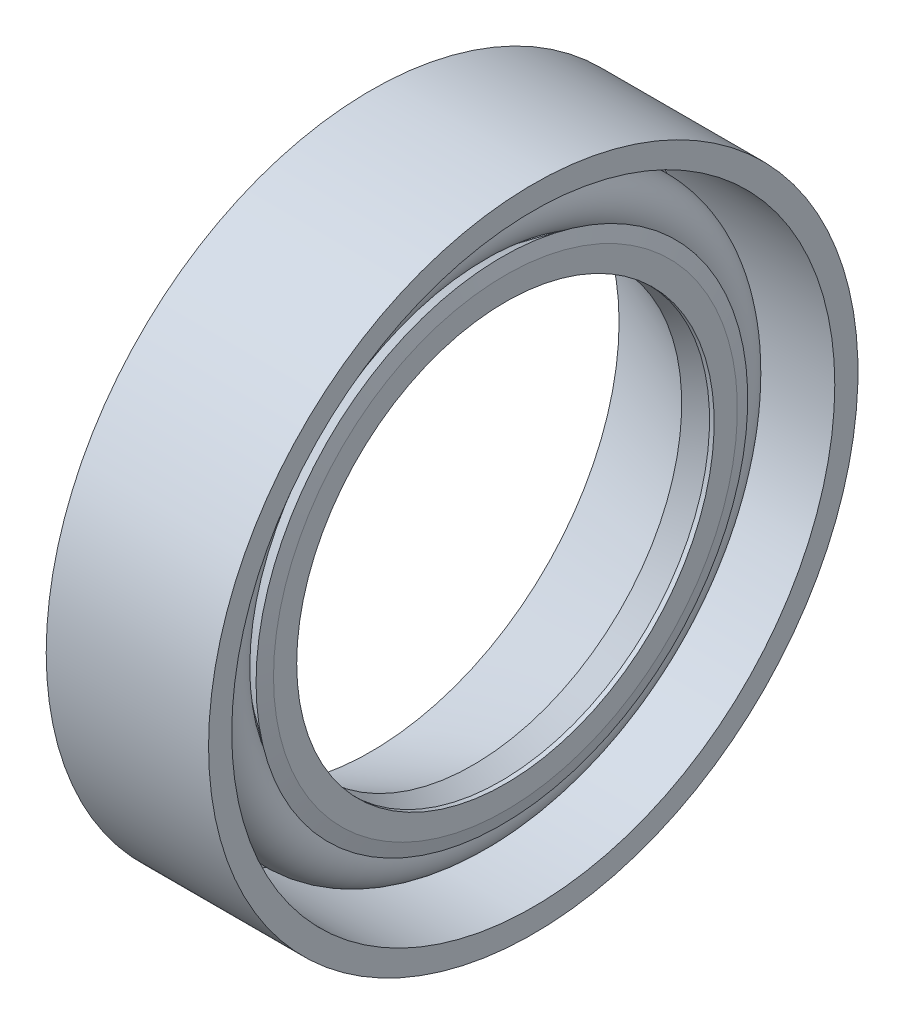
from build123d import *


with BuildPart() as part:
    # Sketch1 → Revolve5 (revolve)
    with BuildSketch(Plane.XY, mode=Mode.PRIVATE) as revolve5_sk:
        with BuildLine():
            Line((0, 7), (3.5, 7))
            Line((3.5, 7), (3.5, 6.5))
            Line((3.5, 6.5), (0.5, 6.5))
            Line((0.5, 6.5), (0.5, 5.5))
            Line((0.5, 5.5), (1.691723883, 5.026212332))
            ThreePointArc((1.691723883, 5.026212332), (2.270416983, 6.065978794), (1.977233578, 4.912703679))
            Line((1.977233578, 4.912703679), (2.17265883, 4.835009445))
            Line((2.17265883, 4.835009445), (2.823645607, 5.3))
            Line((2.823645607, 5.3), (2.9, 5))
            Line((2.9, 5), (2.9, 4.5))
            Line((2.9, 4.5), (2.8, 4.5))
            Line((2.8, 4.5), (2.8, 4.928571429))
            Line((2.8, 4.928571429), (2.2, 4.5))
            Line((2.2, 4.5), (0, 5.35))
            Line((0, 5.35), (0, 7))
        make_face()
    revolve(revolve5_sk.sketch.rotate(Axis((0, 0, 0), (1, 0, 0)), 90), axis=Axis((0, 0, 0), (1, 0, 0)))


solid = part.part
